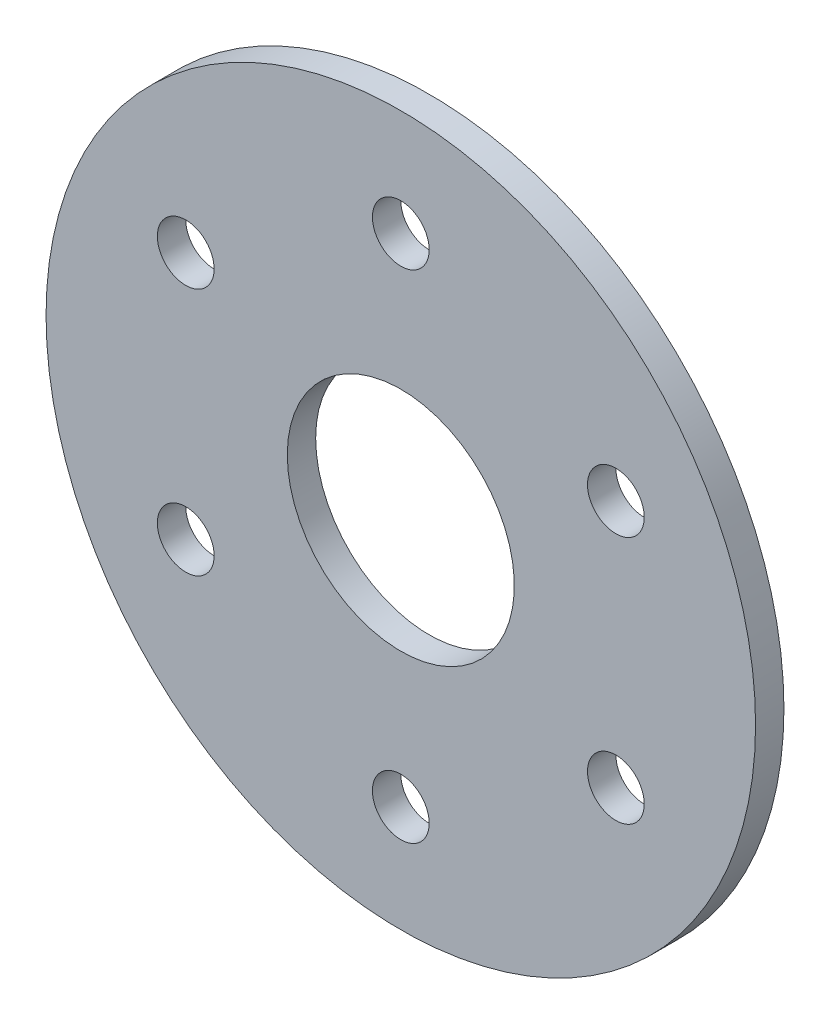
from build123d import *

# Parameters (mm, degrees)
SKETCH1_R               = 12.5
BOSS_EXTRUDE1_DEPTH     = 1
CUT_EXTRUDE2_START      = -2
SKETCH2_R               = 1
CUT_EXTRUDE2_DEPTH      = 20.70593121
CIRPATTERN1_COUNT       = 6
CUT_EXTRUDE3_DEPTH      = 18.70593121
CUT_EXTRUDE3_DEPTH_BACK = 18.70593121
SKETCH4_R               = 4


with BuildPart() as part:
    # Sketch1 → Boss-Extrude1 (new body)
    with BuildSketch(Plane.XY):
        Circle(SKETCH1_R)
    extrude(amount=BOSS_EXTRUDE1_DEPTH)

    # Sketch2 → Cut-Extrude2 (cut)
    with BuildSketch(Plane.XY.offset(CUT_EXTRUDE2_START)):
        with Locations((0, 8.75)):
            Circle(SKETCH2_R)
    cut_extrude2 = extrude(amount=CUT_EXTRUDE2_DEPTH, mode=Mode.SUBTRACT)

    # CirPattern1: Cut-Extrude2 ×6 about axis
    cirpattern1_axis = Axis((0, 0, 0), (0, 0, 1))
    for i in range(1, CIRPATTERN1_COUNT):
        add(cut_extrude2.rotate(cirpattern1_axis, i * 360 / CIRPATTERN1_COUNT), mode=Mode.SUBTRACT)

    # Sketch4 → Cut-Extrude3 (cut, two sides: drawn at the far end of the back side and taken through both)
    with BuildSketch(Plane(origin=(0, 0, 0), x_dir=(-1, 0, 0), z_dir=(0, 0, -1)).offset(-CUT_EXTRUDE3_DEPTH_BACK)):
        Circle(SKETCH4_R)
    extrude(amount=CUT_EXTRUDE3_DEPTH + CUT_EXTRUDE3_DEPTH_BACK, mode=Mode.SUBTRACT)


solid = part.part
